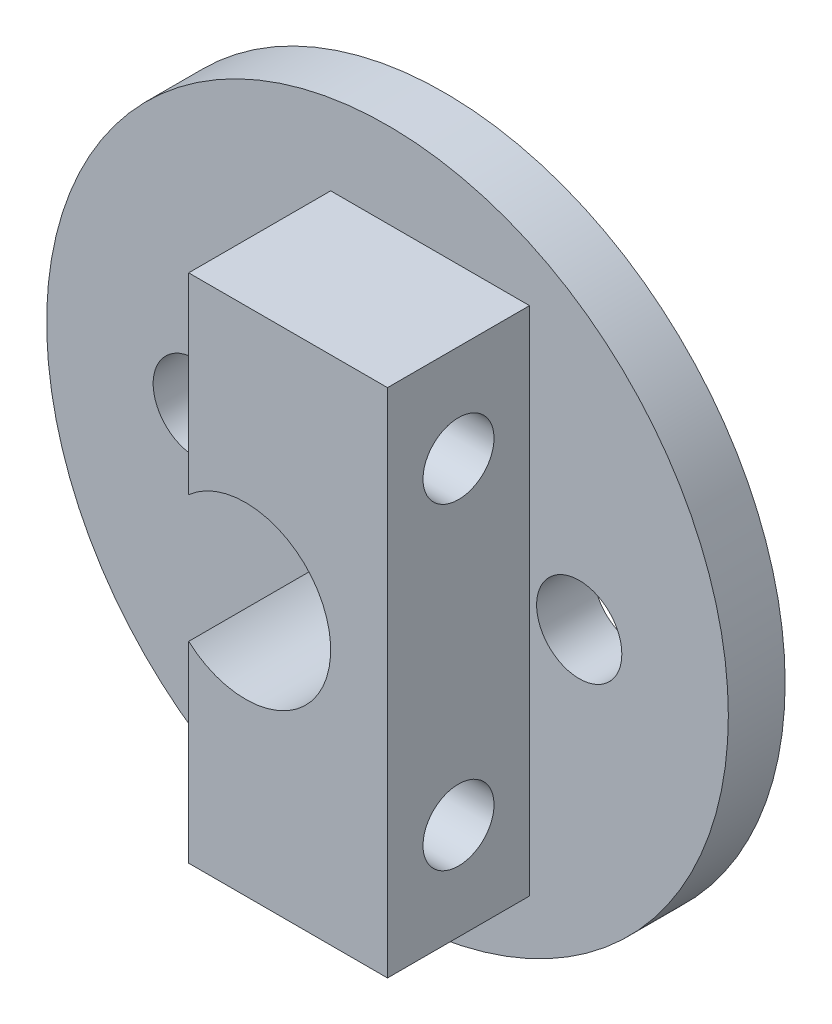
from build123d import *

# Parameters (mm, degrees)
ESQUISSE1_R             = 12
ESQUISSE1_R_2           = 1.5
ESQUISSE1_R_3           = 3
BOSS_EXTRU_1_DEPTH      = 2
BOSS_EXTRU_2_DEPTH      = 5
ESQUISSE3_R             = 1.25
ENL_V_MAT_EXTRU_1_DEPTH = 20.723082923


with BuildPart() as part:
    # Esquisse1 → Boss.-Extru.1 (new body)
    with BuildSketch(Plane.XY):
        Circle(ESQUISSE1_R)
        with Locations((-6.75, 0)):
            Circle(ESQUISSE1_R_2, mode=Mode.SUBTRACT)
        with Locations((6.75, 0)):
            Circle(ESQUISSE1_R_2, mode=Mode.SUBTRACT)
        Circle(ESQUISSE1_R_3, mode=Mode.SUBTRACT)
    extrude(amount=BOSS_EXTRU_1_DEPTH)

    # Esquisse2 → Boss.-Extru.2 (add)
    with BuildSketch(Plane.XY.offset(2)):
        with BuildLine():
            Line((-2, -2.236067977), (-2, -9))
            Line((-2, -9), (5, -9))
            Line((5, -9), (5, 9))
            Line((5, 9), (-2, 9))
            Line((-2, 9), (-2, 2.236067977))
            ThreePointArc((-2, 2.236067977), (3, 0), (-2, -2.236067977))
        make_face()
    extrude(amount=BOSS_EXTRU_2_DEPTH)

    # Esquisse3 → Enlèv. mat.-Extru.1 (cut, through all)
    with BuildSketch(Plane.ZY.offset(2)):
        with Locations(Location((4.5, 5.586067977, 0), (0, 0, 270))):
            Circle(ESQUISSE3_R)
        with Locations(Location((4.5, -5.586067977, 0), (0, 0, 270))):
            Circle(ESQUISSE3_R)
    extrude(amount=-ENL_V_MAT_EXTRU_1_DEPTH, mode=Mode.SUBTRACT)


solid = part.part
